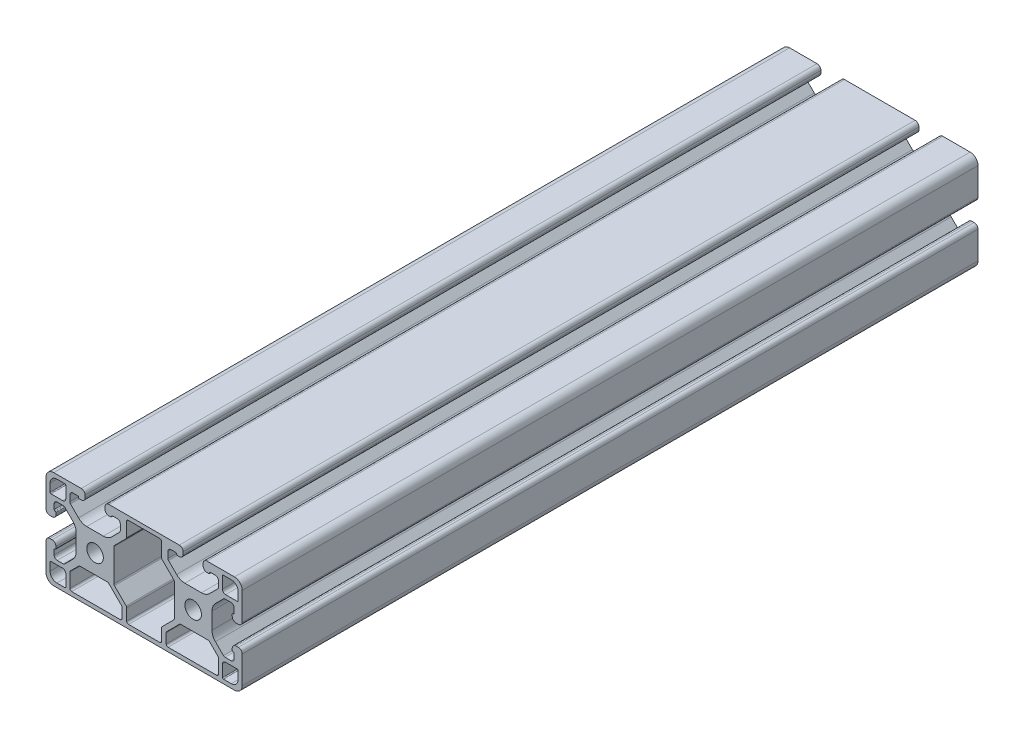
from build123d import *

# Parameters (mm, degrees)
SKETCH1_R      = 3.377777778
EXTRUDE1_DEPTH = 300


with BuildPart() as part:
    # Sketch1 → Extrude1 (new body)
    with BuildSketch(Plane.XY):
        with BuildLine():
            Line((-5.638095233, 20), (-34.361904757, 20))
            ThreePointArc((-34.361904757, 20), (-35.47531734, 19.538809408), (-35.936507932, 18.425396825))
            Line((-35.936507932, 18.425396825), (-35.936507932, 17.511111111))
            ThreePointArc((-35.936507932, 17.511111111), (-35.47531734, 16.397698529), (-34.361904757, 15.936507937))
            Line((-34.361904757, 15.936507937), (-33.655427297, 15.936507937))
            ThreePointArc((-33.655427297, 15.936507937), (-33.391490108, 16.043145483), (-33.275706247, 16.303200291))
            Line((-33.275706247, 16.303200291), (-33.274710305, 16.331720344))
            ThreePointArc((-33.274710305, 16.331720344), (-33.158926445, 16.591775152), (-32.894989256, 16.698412698))
            Line((-32.894989256, 16.698412698), (-30.984126979, 16.698412698))
            ThreePointArc((-30.984126979, 16.698412698), (-30.086213606, 16.326484802), (-29.714285709, 15.428571429))
            Line((-29.714285709, 15.428571429), (-29.714285709, 12.988478889))
            ThreePointArc((-29.714285709, 12.988478889), (-29.781948347, 12.648315838), (-29.974635237, 12.359939528))
            Line((-29.974635237, 12.359939528), (-33.261024748, 9.073550017))
            ThreePointArc((-33.261024748, 9.073550017), (-34.801778176, 8.04405149), (-36.619220763, 7.682539683))
            Line((-36.619220763, 7.682539683), (-43.380779228, 7.682539683))
            ThreePointArc((-43.380779228, 7.682539683), (-45.198221814, 8.04405149), (-46.738975243, 9.073550017))
            Line((-46.738975243, 9.073550017), (-50.025364753, 12.359939528))
            ThreePointArc((-50.025364753, 12.359939528), (-50.218051643, 12.648315838), (-50.285714281, 12.988478889))
            Line((-50.285714281, 12.988478889), (-50.285714281, 15.428571429))
            ThreePointArc((-50.285714281, 15.428571429), (-49.913786384, 16.326484802), (-49.015873011, 16.698412698))
            Line((-49.015873011, 16.698412698), (-46.738094864, 16.698412698))
            Line((-46.738094864, 16.698412698), (-46.711488564, 15.936507937))
            Line((-46.711488564, 15.936507937), (-45.638095233, 15.936507937))
            ThreePointArc((-45.638095233, 15.936507937), (-44.524682651, 16.397698529), (-44.063492059, 17.511111111))
            Line((-44.063492059, 17.511111111), (-44.063492059, 18.425396825))
            ThreePointArc((-44.063492059, 18.425396825), (-44.524682651, 19.538809408), (-45.638095233, 20))
            Line((-45.638095233, 20), (-56.825396821, 20))
            ThreePointArc((-56.825396821, 20), (-59.070242112, 19.070118397), (-59.99999999, 16.825221858))
            Line((-59.99999999, 16.825221858), (-59.999383417, 5.638095238))
            ThreePointArc((-59.999383417, 5.638095238), (-59.538192824, 4.524682656), (-58.424780242, 4.063492063))
            Line((-58.424780242, 4.063492063), (-57.510494528, 4.063492063))
            ThreePointArc((-57.510494528, 4.063492063), (-56.397081945, 4.524682656), (-55.935891353, 5.638095238))
            Line((-55.935891353, 5.638095238), (-55.935891353, 6.309248654))
            ThreePointArc((-55.935891353, 6.309248654), (-56.042528899, 6.573185842), (-56.302583708, 6.688969703))
            Line((-56.302583708, 6.688969703), (-56.33110376, 6.689965645))
            ThreePointArc((-56.33110376, 6.689965645), (-56.591158569, 6.805749505), (-56.697796115, 7.069686694))
            Line((-56.697796115, 7.069686694), (-56.697796115, 9.015873016))
            ThreePointArc((-56.697796115, 9.015873016), (-56.325868218, 9.913786389), (-55.427954845, 10.285714286))
            Line((-55.427954845, 10.285714286), (-52.988478889, 10.285714286))
            ThreePointArc((-52.988478889, 10.285714286), (-52.648315838, 10.218051648), (-52.359939528, 10.025364758))
            Line((-52.359939528, 10.025364758), (-49.073550017, 6.738975247))
            ThreePointArc((-49.073550017, 6.738975247), (-48.04405149, 5.198221819), (-47.682539683, 3.380779233))
            Line((-47.682539683, 3.380779233), (-47.682539683, -3.380779233))
            ThreePointArc((-47.682539683, -3.380779233), (-48.04405149, -5.198221819), (-49.073550017, -6.738975247))
            Line((-49.073550017, -6.738975247), (-52.359939528, -10.025364758))
            ThreePointArc((-52.359939528, -10.025364758), (-52.648315838, -10.218051648), (-52.988478889, -10.285714286))
            Line((-52.988478889, -10.285714286), (-55.428571429, -10.285714286))
            ThreePointArc((-55.428571429, -10.285714286), (-56.326484802, -9.913786389), (-56.698412698, -9.015873016))
            Line((-56.698412698, -9.015873016), (-56.698412698, -7.105010739))
            ThreePointArc((-56.698412698, -7.105010739), (-56.586773444, -6.835990469), (-56.317460317, -6.725059549))
            ThreePointArc((-56.317460317, -6.725059549), (-56.048147191, -6.614128629), (-55.936507937, -6.345108359))
            Line((-55.936507937, -6.345108359), (-55.936507937, -5.638095238))
            ThreePointArc((-55.936507937, -5.638095238), (-56.397698529, -4.524682656), (-57.511111111, -4.063492063))
            Line((-57.511111111, -4.063492063), (-58.425396825, -4.063492063))
            ThreePointArc((-58.425396825, -4.063492063), (-59.538809408, -4.524682656), (-60, -5.638095238))
            Line((-60, -5.638095238), (-60, -16.825396825))
            ThreePointArc((-60, -16.825396825), (-59.070180258, -19.070180258), (-56.825396825, -20))
            Line((-56.825396825, -20), (16.825396825, -20))
            ThreePointArc((16.825396825, -20), (19.070180258, -19.070180258), (20, -16.825396825))
            Line((20, -16.825396825), (20, -5.638095238))
            ThreePointArc((20, -5.638095238), (19.538809408, -4.524682656), (18.425396825, -4.063492063))
            Line((18.425396825, -4.063492063), (17.511111116, -4.063492063))
            ThreePointArc((17.511111116, -4.063492063), (16.397698533, -4.524682656), (15.936507941, -5.638095238))
            Line((15.936507941, -5.638095238), (15.936507941, -6.344572699))
            ThreePointArc((15.936507941, -6.344572699), (16.043145488, -6.608509887), (16.303200296, -6.724293748))
            Line((16.303200296, -6.724293748), (16.331720349, -6.72528969))
            ThreePointArc((16.331720349, -6.72528969), (16.591775157, -6.84107355), (16.698412703, -7.105010739))
            Line((16.698412703, -7.105010739), (16.698412703, -9.015873016))
            ThreePointArc((16.698412703, -9.015873016), (16.326484806, -9.913786389), (15.428571433, -10.285714286))
            Line((15.428571433, -10.285714286), (12.988478893, -10.285714286))
            ThreePointArc((12.988478893, -10.285714286), (12.648315842, -10.218051648), (12.359939532, -10.025364758))
            Line((12.359939532, -10.025364758), (9.073550022, -6.738975247))
            ThreePointArc((9.073550022, -6.738975247), (8.044051495, -5.198221819), (7.682539687, -3.380779233))
            Line((7.682539687, -3.380779233), (7.682539687, 3.380779233))
            ThreePointArc((7.682539687, 3.380779233), (8.044051495, 5.198221819), (9.073550022, 6.738975247))
            Line((9.073550022, 6.738975247), (12.359939532, 10.025364758))
            ThreePointArc((12.359939532, 10.025364758), (12.648315842, 10.218051648), (12.988478893, 10.285714286))
            Line((12.988478893, 10.285714286), (15.428571433, 10.285714286))
            ThreePointArc((15.428571433, 10.285714286), (16.326484806, 9.913786389), (16.698412703, 9.015873016))
            Line((16.698412703, 9.015873016), (16.698412703, 7.105010739))
            ThreePointArc((16.698412703, 7.105010739), (16.591775157, 6.84107355), (16.331720349, 6.72528969))
            Line((16.331720349, 6.72528969), (16.303200296, 6.724293748))
            ThreePointArc((16.303200296, 6.724293748), (16.043145488, 6.608509887), (15.936507941, 6.344572699))
            Line((15.936507941, 6.344572699), (15.936507941, 5.574603175))
            ThreePointArc((15.936507941, 5.574603175), (16.41259988, 4.50120899), (17.502206462, 4.063492063))
            Line((17.502206462, 4.063492063), (18.416492176, 4.063492063))
            ThreePointArc((18.416492176, 4.063492063), (19.508764308, 4.504131696), (20.000000005, 5.574603175))
            Line((20.000000005, 5.574603175), (20.000000005, 16.825396825))
            ThreePointArc((20.000000005, 16.825396825), (19.070180263, 19.070180258), (16.82539683, 20))
            Line((16.82539683, 20), (5.638095243, 20))
            ThreePointArc((5.638095243, 20), (4.52468266, 19.538809408), (4.063492068, 18.425396825))
            Line((4.063492068, 18.425396825), (4.063492068, 17.511111111))
            ThreePointArc((4.063492068, 17.511111111), (4.52468266, 16.397698529), (5.638095243, 15.936507937))
            Line((5.638095243, 15.936507937), (6.344572703, 15.936507937))
            ThreePointArc((6.344572703, 15.936507937), (6.608509892, 16.043145483), (6.724293753, 16.303200291))
            Line((6.724293753, 16.303200291), (6.725289695, 16.331720344))
            ThreePointArc((6.725289695, 16.331720344), (6.841073555, 16.591775152), (7.105010744, 16.698412698))
            Line((7.105010744, 16.698412698), (9.015873021, 16.698412698))
            ThreePointArc((9.015873021, 16.698412698), (9.913786394, 16.326484802), (10.285714291, 15.428571429))
            Line((10.285714291, 15.428571429), (10.285714291, 12.988478889))
            ThreePointArc((10.285714291, 12.988478889), (10.218051653, 12.648315838), (10.025364763, 12.359939528))
            Line((10.025364763, 12.359939528), (6.738975252, 9.073550017))
            ThreePointArc((6.738975252, 9.073550017), (5.198221824, 8.04405149), (3.380779237, 7.682539683))
            Line((3.380779237, 7.682539683), (-3.380779228, 7.682539683))
            ThreePointArc((-3.380779228, 7.682539683), (-5.198221814, 8.04405149), (-6.738975243, 9.073550017))
            Line((-6.738975243, 9.073550017), (-10.025364753, 12.359939528))
            ThreePointArc((-10.025364753, 12.359939528), (-10.218051643, 12.648315838), (-10.285714281, 12.988478889))
            Line((-10.285714281, 12.988478889), (-10.285714281, 15.434578582))
            ThreePointArc((-10.285714281, 15.434578582), (-9.912600706, 16.333676069), (-9.012521622, 16.704415429))
            Line((-9.012521622, 16.704415429), (-7.10404173, 16.699378516))
            ThreePointArc((-7.10404173, 16.699378516), (-6.840746879, 16.59239376), (-6.725323458, 16.332687484))
            Line((-6.725323458, 16.332687484), (-6.724293743, 16.303200291))
            ThreePointArc((-6.724293743, 16.303200291), (-6.608509882, 16.043145483), (-6.344572694, 15.936507937))
            Line((-6.344572694, 15.936507937), (-5.638095233, 15.936507937))
            ThreePointArc((-5.638095233, 15.936507937), (-4.524682651, 16.397698529), (-4.063492059, 17.511111111))
            Line((-4.063492059, 17.511111111), (-4.063492059, 18.425396825))
            ThreePointArc((-4.063492059, 18.425396825), (-4.524682651, 19.538809408), (-5.638095233, 20))
        make_face()
        Circle(SKETCH1_R, mode=Mode.SUBTRACT)
        with Locations((-40, 0)):
            Circle(SKETCH1_R, mode=Mode.SUBTRACT)
        with BuildLine():
            Line((-10.984126984, -17.587301587), (-10.984126984, -13.634293039))
            ThreePointArc((-10.984126984, -13.634293039), (-10.926130437, -13.34272471), (-10.760970246, -13.095545016))
            Line((-10.760970246, -13.095545016), (-5.571121651, -7.905696421))
            ThreePointArc((-5.571121651, -7.905696421), (-5.323941957, -7.740536229), (-5.032373627, -7.682539683))
            Line((-5.032373627, -7.682539683), (6.109869675, -7.682539683))
            ThreePointArc((6.109869675, -7.682539683), (6.401438004, -7.740536229), (6.648617699, -7.905696421))
            Line((6.648617699, -7.905696421), (10.062557548, -11.31963627))
            ThreePointArc((10.062557548, -11.31963627), (10.227717739, -11.566815964), (10.285714286, -11.858384293))
            Line((10.285714286, -11.858384293), (10.285714286, -17.587301587))
            ThreePointArc((10.285714286, -17.587301587), (10.062557548, -18.126049611), (9.523809524, -18.349206349))
            Line((9.523809524, -18.349206349), (-10.222222222, -18.349206349))
            ThreePointArc((-10.222222222, -18.349206349), (-10.760970246, -18.126049611), (-10.984126984, -17.587301587))
        make_face(mode=Mode.SUBTRACT)
        with BuildLine():
            Line((-46.109869675, -7.682539683), (-34.967626373, -7.682539683))
            ThreePointArc((-34.967626373, -7.682539683), (-34.676058043, -7.740536229), (-34.428878349, -7.905696421))
            Line((-34.428878349, -7.905696421), (-29.239029754, -13.095545016))
            ThreePointArc((-29.239029754, -13.095545016), (-29.073869563, -13.34272471), (-29.015873016, -13.634293039))
            Line((-29.015873016, -13.634293039), (-29.015873016, -17.587301587))
            ThreePointArc((-29.015873016, -17.587301587), (-29.239029754, -18.126049611), (-29.777777778, -18.349206349))
            Line((-29.777777778, -18.349206349), (-49.523809524, -18.349206349))
            ThreePointArc((-49.523809524, -18.349206349), (-50.062557548, -18.126049611), (-50.285714286, -17.587301587))
            Line((-50.285714286, -17.587301587), (-50.285714286, -11.858384293))
            ThreePointArc((-50.285714286, -11.858384293), (-50.227717739, -11.566815964), (-50.062557548, -11.31963627))
            Line((-50.062557548, -11.31963627), (-46.648617699, -7.905696421))
            ThreePointArc((-46.648617699, -7.905696421), (-46.401438004, -7.740536229), (-46.109869675, -7.682539683))
        make_face(mode=Mode.SUBTRACT)
        with BuildLine():
            Line((-13.650793651, -18.349206349), (-26.349206349, -18.349206349))
            ThreePointArc((-26.349206349, -18.349206349), (-26.887954373, -18.126049611), (-27.111111111, -17.587301587))
            Line((-27.111111111, -17.587301587), (-27.111111111, -12.845314825))
            ThreePointArc((-27.111111111, -12.845314825), (-27.169107658, -12.553746496), (-27.334267849, -12.306566802))
            Line((-27.334267849, -12.306566802), (-32.094303579, -7.546531072))
            ThreePointArc((-32.094303579, -7.546531072), (-32.259463771, -7.299351377), (-32.317460317, -7.007783048))
            Line((-32.317460317, -7.007783048), (-32.317460317, 6.109869675))
            ThreePointArc((-32.317460317, 6.109869675), (-32.259463771, 6.401438004), (-32.094303579, 6.648617699))
            Line((-32.094303579, 6.648617699), (-27.397759913, 11.345161365))
            ThreePointArc((-27.397759913, 11.345161365), (-27.232599721, 11.592341059), (-27.174603175, 11.883909389))
            Line((-27.174603175, 11.883909389), (-27.174603175, 17.587301587))
            ThreePointArc((-27.174603175, 17.587301587), (-26.951446436, 18.126049611), (-26.412698413, 18.349206349))
            Line((-26.412698413, 18.349206349), (-13.587301587, 18.349206349))
            ThreePointArc((-13.587301587, 18.349206349), (-13.048553564, 18.126049611), (-12.825396825, 17.587301587))
            Line((-12.825396825, 17.587301587), (-12.825396825, 11.883909389))
            ThreePointArc((-12.825396825, 11.883909389), (-12.767400279, 11.592341059), (-12.602240087, 11.345161365))
            Line((-12.602240087, 11.345161365), (-7.905696421, 6.648617699))
            ThreePointArc((-7.905696421, 6.648617699), (-7.740536229, 6.401438004), (-7.682539683, 6.109869675))
            Line((-7.682539683, 6.109869675), (-7.682539683, -7.007783048))
            ThreePointArc((-7.682539683, -7.007783048), (-7.740536229, -7.299351377), (-7.905696421, -7.546531072))
            Line((-7.905696421, -7.546531072), (-12.665732151, -12.306566802))
            ThreePointArc((-12.665732151, -12.306566802), (-12.830892342, -12.553746496), (-12.888888889, -12.845314825))
            Line((-12.888888889, -12.845314825), (-12.888888889, -17.587301587))
            ThreePointArc((-12.888888889, -17.587301587), (-13.112045627, -18.126049611), (-13.650793651, -18.349206349))
        make_face(mode=Mode.SUBTRACT)
        with BuildLine():
            Line((-52.316460442, -18.349206349), (-55.555507937, -18.349206349))
            ThreePointArc((-55.555507937, -18.349206349), (-57.531164283, -17.530862696), (-58.349507937, -15.555206349))
            Line((-58.349507937, -15.555206349), (-58.349507937, -12.316507937))
            ThreePointArc((-58.349507937, -12.316507937), (-58.238208513, -12.04780736), (-57.969507937, -11.936507937))
            Line((-57.969507937, -11.936507937), (-53.206349206, -11.936507937))
            ThreePointArc((-53.206349206, -11.936507937), (-52.308435833, -12.308435833), (-51.936507937, -13.206349206))
            Line((-51.936507937, -13.206349206), (-51.936507937, -17.969253843))
            ThreePointArc((-51.936507937, -17.969253843), (-52.047793449, -18.237920837), (-52.316460442, -18.349206349))
        make_face(mode=Mode.SUBTRACT)
        with BuildLine():
            Line((-55.555507937, 18.349206349), (-52.316460442, 18.349206349))
            ThreePointArc((-52.316460442, 18.349206349), (-52.047793449, 18.237920837), (-51.936507937, 17.969253843))
            Line((-51.936507937, 17.969253843), (-51.936507937, 13.206349206))
            ThreePointArc((-51.936507937, 13.206349206), (-52.308435833, 12.308435833), (-53.206349206, 11.936507937))
            Line((-53.206349206, 11.936507937), (-57.969507937, 11.936507937))
            ThreePointArc((-57.969507937, 11.936507937), (-58.238208513, 12.04780736), (-58.349507937, 12.316507937))
            Line((-58.349507937, 12.316507937), (-58.349507937, 15.555206349))
            ThreePointArc((-58.349507937, 15.555206349), (-57.531164283, 17.530862696), (-55.555507937, 18.349206349))
        make_face(mode=Mode.SUBTRACT)
        with BuildLine():
            Line((15.555507937, -18.349206349), (12.316460442, -18.349206349))
            ThreePointArc((12.316460442, -18.349206349), (12.047793449, -18.237920837), (11.936507937, -17.969253843))
            Line((11.936507937, -17.969253843), (11.936507937, -13.206349206))
            ThreePointArc((11.936507937, -13.206349206), (12.308435833, -12.308435833), (13.206349206, -11.936507937))
            Line((13.206349206, -11.936507937), (17.969507937, -11.936507937))
            ThreePointArc((17.969507937, -11.936507937), (18.238208513, -12.04780736), (18.349507937, -12.316507937))
            Line((18.349507937, -12.316507937), (18.349507937, -15.555206349))
            ThreePointArc((18.349507937, -15.555206349), (17.531164283, -17.530862696), (15.555507937, -18.349206349))
        make_face(mode=Mode.SUBTRACT)
        with BuildLine():
            Line((12.316460442, 18.349206349), (15.555507937, 18.349206349))
            ThreePointArc((15.555507937, 18.349206349), (17.531164283, 17.530862696), (18.349507937, 15.555206349))
            Line((18.349507937, 15.555206349), (18.349507937, 12.316507937))
            ThreePointArc((18.349507937, 12.316507937), (18.238208513, 12.04780736), (17.969507937, 11.936507937))
            Line((17.969507937, 11.936507937), (13.206349206, 11.936507937))
            ThreePointArc((13.206349206, 11.936507937), (12.308435833, 12.308435833), (11.936507937, 13.206349206))
            Line((11.936507937, 13.206349206), (11.936507937, 17.969253843))
            ThreePointArc((11.936507937, 17.969253843), (12.047793449, 18.237920837), (12.316460442, 18.349206349))
        make_face(mode=Mode.SUBTRACT)
    extrude(amount=-EXTRUDE1_DEPTH)


solid = part.part
